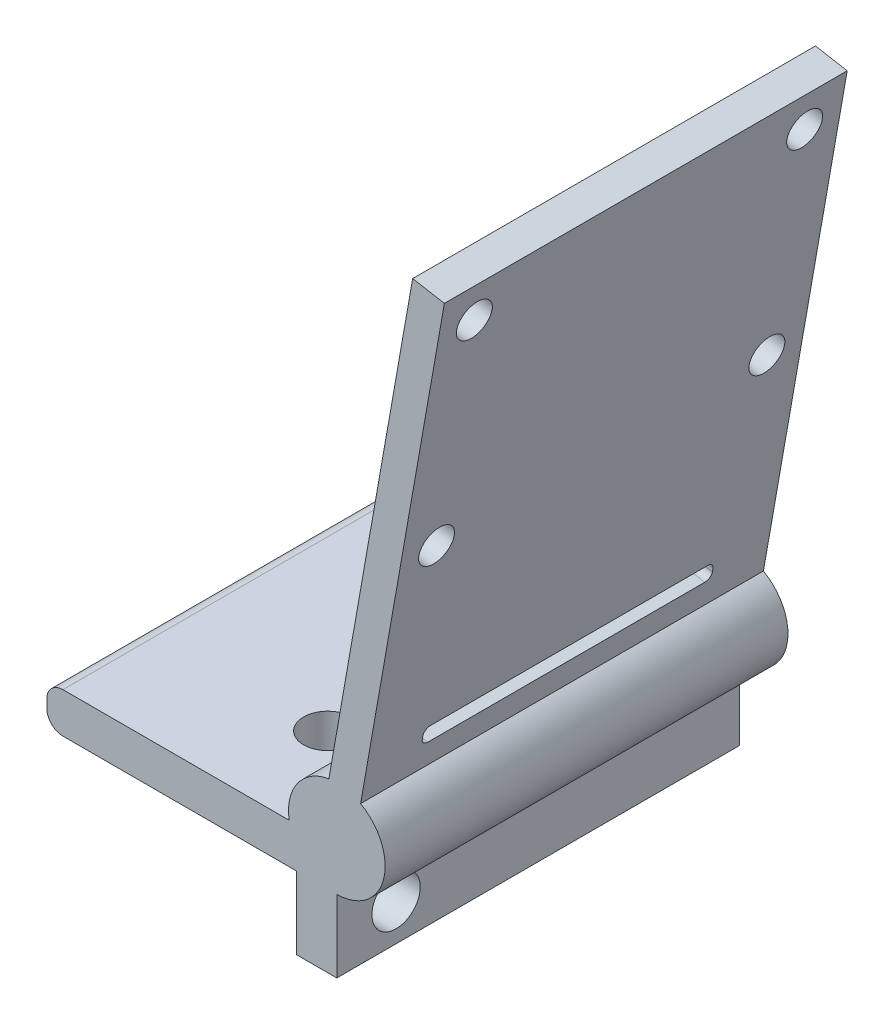
from build123d import *

# Parameters (mm, degrees)
SKETCH1_R           = 3
BOSS_EXTRUDE2_DEPTH = 12.5
CUT_EXTRUDE1_DEPTH  = 2
SKETCH4_R           = 1.5
CUT_EXTRUDE4_DEPTH  = 2.5
SKETCH5_W           = 2.5
SKETCH5_H           = 4.5
BOSS_EXTRUDE3_DEPTH = 25
SKETCH6_R           = 1.500002847
CUT_EXTRUDE5_DEPTH  = 2.5
SKETCH7_R           = 1.1
CUT_EXTRUDE6_DEPTH  = 2


with BuildPart() as part:
    # Sketch1 → Boss-Extrude2 (new, symmetric)
    with BuildSketch(Plane.XY):
        Circle(SKETCH1_R)
        with BuildLine():
            Line((0, -3), (0, -0.5))
            Line((0, -0.5), (-17, -0.5))
            ThreePointArc((-17, -0.5), (-17.707106781, -0.792893219), (-18, -1.5))
            Line((-18, -1.5), (-18, -2))
            ThreePointArc((-18, -2), (-17.707106781, -2.707106781), (-17, -3))
            Line((-17, -3), (0, -3))
        make_face()
        Polygon((6.675258535, 32.098501889), (0.984807753, -0.173648178), (-0.984807753, 0.173648178), (4.705643029, 32.445798244), align=None)
    extrude(amount=BOSS_EXTRUDE2_DEPTH, both=True)

    # Sketch2 → Cut-Extrude1 (cut)
    with BuildSketch(Plane(origin=(0.9848077530122124, -0.17364817766692678, 0), x_dir=(0, 0, -1), z_dir=(0.9848077530122088, -0.17364817766692617, 0))):
        with BuildLine():
            Line((-8.6, 4.328427125), (8.6, 4.328427125))
            ThreePointArc((8.6, 4.328427125), (8.882842712, 4.445584412), (9, 4.728427125))
            Line((9, 4.728427125), (9, 4.928427125))
            ThreePointArc((9, 4.928427125), (8.882842712, 5.211269837), (8.6, 5.328427125))
            Line((8.6, 5.328427125), (-8.6, 5.328427125))
            ThreePointArc((-8.6, 5.328427125), (-8.882842712, 5.211269837), (-9, 4.928427125))
            Line((-9, 4.928427125), (-9, 4.728427125))
            ThreePointArc((-9, 4.728427125), (-8.882842712, 4.445584412), (-8.6, 4.328427125))
        make_face()
    extrude(amount=-CUT_EXTRUDE1_DEPTH, mode=Mode.SUBTRACT)

    # Sketch4 → Cut-Extrude4 (cut)
    with BuildSketch(Plane.XZ.offset(3)):
        with Locations((-6.562669804, 6.5)):
            Circle(SKETCH4_R)
        with Locations((-6.562669804, -6.5)):
            Circle(SKETCH4_R)
    extrude(amount=-CUT_EXTRUDE4_DEPTH, mode=Mode.SUBTRACT)

    # Sketch5 → Boss-Extrude3 (add)
    with BuildSketch(Plane.XY.offset(12.5)):
        with Locations((-1.25, -5.25)):
            Rectangle(SKETCH5_W, SKETCH5_H)
    extrude(amount=-BOSS_EXTRUDE3_DEPTH)

    # Sketch6 → Cut-Extrude5 (cut)
    with BuildSketch(Plane(origin=(0, 0, 0), x_dir=(0, 0, -1), z_dir=(1, 0, 0))):
        with Locations(Location((-8.822806399, -5.193294881, 0), (0, 0, 90))):
            Circle(SKETCH6_R)
    extrude(amount=-CUT_EXTRUDE5_DEPTH, mode=Mode.SUBTRACT)

    # Sketch7 → Cut-Extrude6 (cut)
    with BuildSketch(Plane(origin=(0.9848077530122124, -0.17364817766692678, 0), x_dir=(0, 0, -1), z_dir=(0.9848077530122088, -0.17364817766692617, 0))):
        with Locations(Location((-10.25, 30.52, 0), (0, 0, 90))):
            Circle(SKETCH7_R)
        with Locations(Location((-10.25, 17.02, 0), (0, 0, 90))):
            Circle(SKETCH7_R)
        with Locations(Location((10.25, 17.02, 0), (0, 0, 90))):
            Circle(SKETCH7_R)
        with Locations(Location((10.25, 30.52, 0), (0, 0, 90))):
            Circle(SKETCH7_R)
    extrude(amount=-CUT_EXTRUDE6_DEPTH, mode=Mode.SUBTRACT)


solid = part.part
